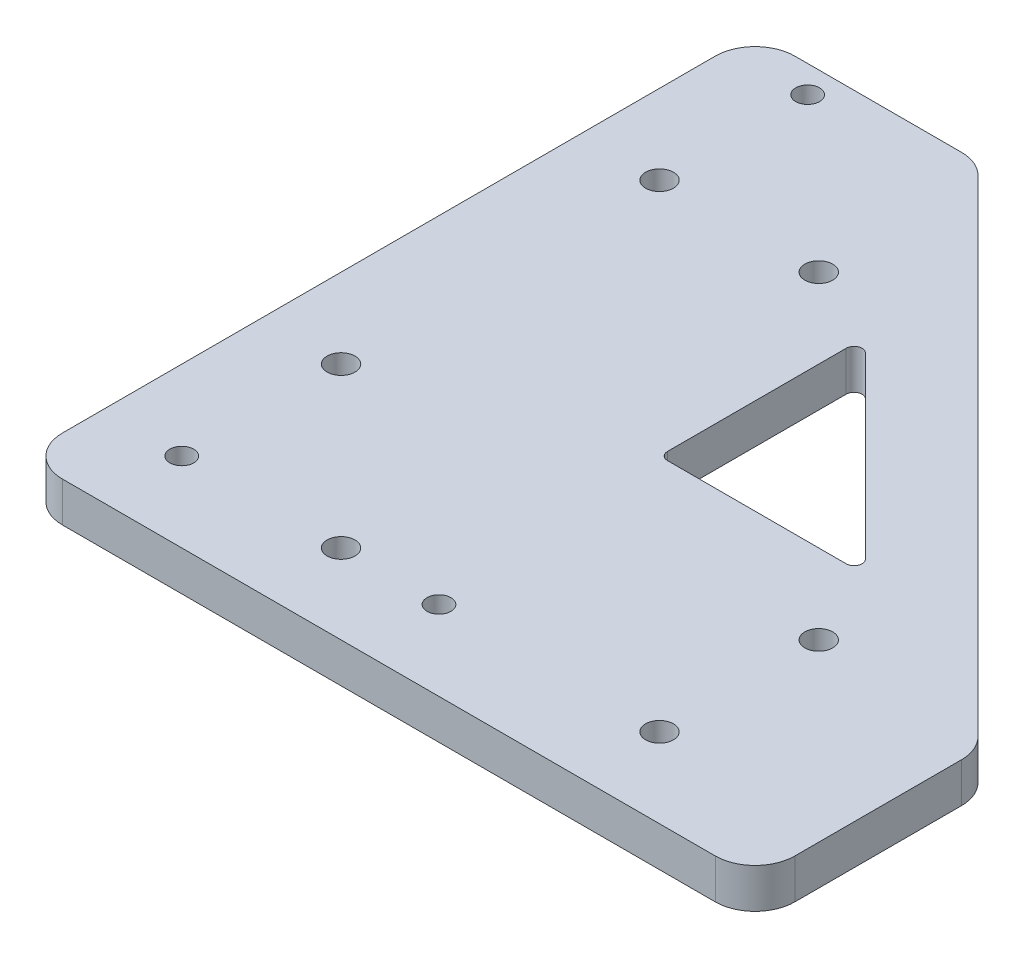
from build123d import *

# Parameters (mm, degrees)
ESBO_O1_R                  = 1.75
RESSALTO_EXTRUS_O1_DEPTH   = 5
RESSALTO_EXTRUS_O3_DEPTH   = 5
CORTE_EXTRUS_O1_DEPTH      = 131.203684057
CORTE_EXTRUS_O1_DEPTH_BACK = 131.203684057
ESBO_O3_R                  = 1.5
FILETE1_R                  = 5


with BuildPart() as part:
    # Esboço1 → Ressalto-extrusão1 (new body)
    with BuildSketch(Plane(origin=(0, 0, 0), x_dir=(1, 0, 0), z_dir=(0, 1, 0))):
        Polygon((0, 79.999998212), (0, 0), (79.999998212, 0), (79.999998212, 39.999999106), (39.999999106, 79.999998212), align=None)
        with Locations(Location((10, 69.999998212, 0), (0, 0, 270))):
            Circle(ESBO_O1_R, mode=Mode.SUBTRACT)
        with Locations(Location((30, 69.999998212, 0), (0, 0, 270))):
            Circle(ESBO_O1_R, mode=Mode.SUBTRACT)
        with Locations(Location((10, 29.999998212, 0), (0, 0, 270))):
            Circle(ESBO_O1_R, mode=Mode.SUBTRACT)
        with Locations(Location((69.999998212, 30, 0), (0, 0, 270))):
            Circle(ESBO_O1_R, mode=Mode.SUBTRACT)
        with Locations(Location((29.999998212, 10, 0), (0, 0, 270))):
            Circle(ESBO_O1_R, mode=Mode.SUBTRACT)
        with Locations(Location((69.999998212, 10, 0), (0, 0, 270))):
            Circle(ESBO_O1_R, mode=Mode.SUBTRACT)
        with BuildLine():
            Line((40, 63.443648132), (40, 41))
            ThreePointArc((40, 41), (40.292893219, 40.292893219), (41, 40))
            Line((41, 40), (63.443648132, 40))
            ThreePointArc((63.443648132, 40), (64.367527664, 40.617316568), (64.150754913, 41.707106781))
            Line((64.150754913, 41.707106781), (41.707106781, 64.150754913))
            ThreePointArc((41.707106781, 64.150754913), (40.617316568, 64.367527664), (40, 63.443648132))
        make_face(mode=Mode.SUBTRACT)
    extrude(amount=RESSALTO_EXTRUS_O1_DEPTH)

    # Esboço5 → Ressalto-extrusão3 (add)
    with BuildSketch(Plane.XZ):
        Polygon((79.999998212, 0), (91.999998212, 0), (91.999998212, -27.999999106), (79.999998212, -39.999999106), align=None)
        Polygon((39.999999106, -79.999998212), (27.999999106, -91.999998212), (0, -91.999998212), (0, -79.999998212), align=None)
    extrude(amount=-RESSALTO_EXTRUS_O3_DEPTH)

    # Esboço3 → Corte-extrusão1 (cut, two sides: drawn at the far end of the back side and taken through both)
    with BuildSketch(Plane.XZ.offset(-CORTE_EXTRUS_O1_DEPTH_BACK)):
        with Locations(Location((42.3, -10, 0), (0, 0, 270))):
            Circle(ESBO_O3_R)
        with Locations(Location((10, -88.6, 0), (0, 0, 270))):
            Circle(ESBO_O3_R)
        with Locations(Location((10, -10, 0), (0, 0, 270))):
            Circle(ESBO_O3_R)
    extrude(amount=CORTE_EXTRUS_O1_DEPTH + CORTE_EXTRUS_O1_DEPTH_BACK, mode=Mode.SUBTRACT)

    # Filete1
    filete1_edges = [part.edges().sort_by_distance(p)[0] for p in [
        (91.999998212, 2.5, -27.999999106),
        (91.999998212, 2.5, 0),
        (0, 2.5, -91.999998212),
        (27.999999106, 2.5, -91.999998212),
        (0, 2.5, 0),
    ]]
    fillet(filete1_edges, radius=FILETE1_R)


solid = part.part
